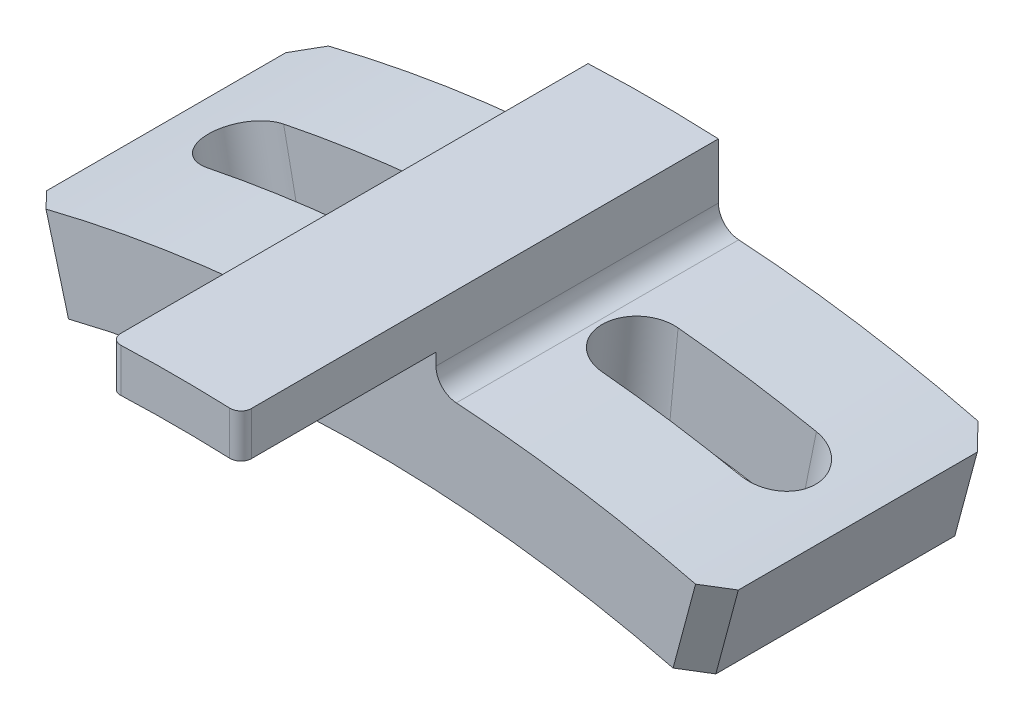
from build123d import *

# Parameters (mm, degrees)
EXTRUDE_1_DEPTH          = 6.5
EXTRUDE_START            = 9
EXTRUDE_2_DEPTH          = 9
PATTERN_CIRCULAR_1_COUNT = 2
PATTERN_CIRCULAR_1_ANGLE = 6
CUT_EXTRUDE_2_DEPTH      = 1.75
FILLET_1_R               = 1
CHAMFER_1_SIZE           = 1
FILLET_2_R               = 0.5


with BuildPart() as part:
    # Эскиз1 → Бобышка-Вытянуть1 (new, symmetric)
    with BuildSketch(Plane.XY):
        with BuildLine():
            Line((14.882095093, 55.540735012), (15.917371274, 59.404438317))
            ThreePointArc((15.917371274, 59.404438317), (9.512581469, 60.7598617), (3, 61.426785688))
            Line((3, 61.426785688), (3, 64.930732323))
            ThreePointArc((3, 64.930732323), (0, 65), (-3, 64.930732323))
            Line((-3, 64.930732323), (-3, 61.426785688))
            ThreePointArc((-3, 61.426785688), (-9.512581469, 60.7598617), (-15.917371274, 59.404438317))
            Line((-15.917371274, 59.404438317), (-14.882095093, 55.540735012))
            ThreePointArc((-14.882095093, 55.540735012), (0, 57.5), (14.882095093, 55.540735012))
        make_face()
    extrude(amount=EXTRUDE_1_DEPTH, both=True)

    # Эскиз2 → Бобышка-Вытянуть2 (add)
    with BuildSketch(Plane.XY.offset(6.5).offset(EXTRUDE_START)):
        with BuildLine():
            Line((3, 62.92853089), (3, 64.930732323))
            ThreePointArc((3, 64.930732323), (0, 65), (-3, 64.930732323))
            Line((-3, 64.930732323), (-3, 62.92853089))
            ThreePointArc((-3, 62.92853089), (0, 63), (3, 62.92853089))
        make_face()
    extrude(amount=-EXTRUDE_2_DEPTH)

    # Эскиз4 → Вырез-Повернуть1 (revolve, cut)
    with BuildSketch(Plane.XY):
        Polygon((15.670623642, 68.245835438), (11.683264954, 48.647341346), (9.968396721, 48.996235231), (13.955755409, 68.594729323), align=None)
    cut_revolve_1 = revolve(axis=Axis((0, 0, 0), (0.19936793441719763, 0.9799247046208296, 0)), mode=Mode.SUBTRACT)

    # Круговой массив1: Вырез-Повернуть1 ×2 about axis
    pattern_circular_1_axis = Axis((0, 0, 6.5), (0, 0, 1))
    for i in range(1, PATTERN_CIRCULAR_1_COUNT):
        add(cut_revolve_1.rotate(pattern_circular_1_axis, i * PATTERN_CIRCULAR_1_ANGLE / (PATTERN_CIRCULAR_1_COUNT - 1)), mode=Mode.SUBTRACT)

    # Эскиз6 → Вырез-Вытянуть2 (cut, symmetric)
    with BuildSketch(Plane.XY):
        with BuildLine():
            Line((5.51113077, 57.235281406), (5.89451378, 61.2168662))
            ThreePointArc((5.89451378, 61.2168662), (9.090278784, 60.824475597), (12.261127967, 60.265369334))
            Line((12.261127967, 60.265369334), (11.463656229, 56.345670516))
            ThreePointArc((11.463656229, 56.345670516), (8.49904114, 56.868412143), (5.51113077, 57.235281406))
        make_face()
    cut_extrude_2 = extrude(amount=CUT_EXTRUDE_2_DEPTH, both=True, mode=Mode.SUBTRACT)

    # Зеркальное отражение1: Вырез-Повернуть1, Вырез-Вытянуть2 across plane
    add(cut_revolve_1.mirror(Plane(origin=(0, 0, 0), x_dir=(0, 0, 1), z_dir=(1, 0, 0))), mode=Mode.SUBTRACT)
    add(cut_extrude_2.mirror(Plane(origin=(0, 0, 0), x_dir=(0, 0, 1), z_dir=(1, 0, 0))), mode=Mode.SUBTRACT)

    # Зеркальное отражение1 copy 1 sketch → Зеркальное отражение1 copy 1 (revolve, cut)
    with BuildSketch(Plane(origin=(0, 0, 0), x_dir=(-0.9945218953682733, 0.10452846326765369, 0), z_dir=(0, 0, 1))):
        Polygon((15.670623642, -68.245835438), (11.683264954, -48.647341346), (9.968396721, -48.996235231), (13.955755409, -68.594729323), align=None)
    revolve(axis=Axis((0, 0, 0), (0.09584575252022422, -0.9953961983671789, 0)), mode=Mode.SUBTRACT)

    # Скругление1
    fillet_1_edges = [part.edges().sort_by_distance(p)[0] for p in [
        (-3, 61.426785688, 0),
        (3, 61.426785688, 0),
    ]]
    fillet(fillet_1_edges, radius=FILLET_1_R)

    # Фаска1
    chamfer_1_edges = [part.edges().sort_by_distance(p)[0] for p in [
        (15.399733184, 57.472586664, -6.5),
        (-15.399733184, 57.472586664, 6.5),
        (-15.399733184, 57.472586664, -6.5),
        (15.399733184, 57.472586664, 6.5),
    ]]
    chamfer(chamfer_1_edges, length=CHAMFER_1_SIZE)

    # Скругление2
    fillet_2_edges = [part.edges().sort_by_distance(p)[0] for p in [
        (-3, 63.929631607, 15.5),
        (3, 63.929631607, 15.5),
    ]]
    fillet(fillet_2_edges, radius=FILLET_2_R)


solid = part.part
